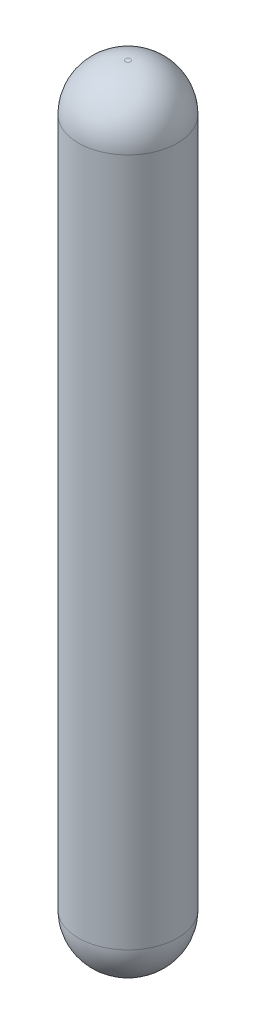
from build123d import *

# Parameters (mm, degrees)
SKETCH2_R           = 3.8
BOSS_EXTRUDE1_DEPTH = 60
FILLET5_R           = 3.6


with BuildPart() as part:
    # Sketch2 → Boss-Extrude1 (new body)
    with BuildSketch(Plane(origin=(0, 0, 0), x_dir=(1, 0, 0), z_dir=(0, 1, 0))):
        with Locations(Location((0, 0, 0), (0, 0, 270))):
            Circle(SKETCH2_R)
    extrude(amount=BOSS_EXTRUDE1_DEPTH)

    # Fillet5
    fillet5_edges = [part.edges().sort_by_distance(p)[0] for p in [
        (0, 0, -3.8),
        (0, 60, -3.8),
    ]]
    fillet(fillet5_edges, radius=FILLET5_R)


solid = part.part
